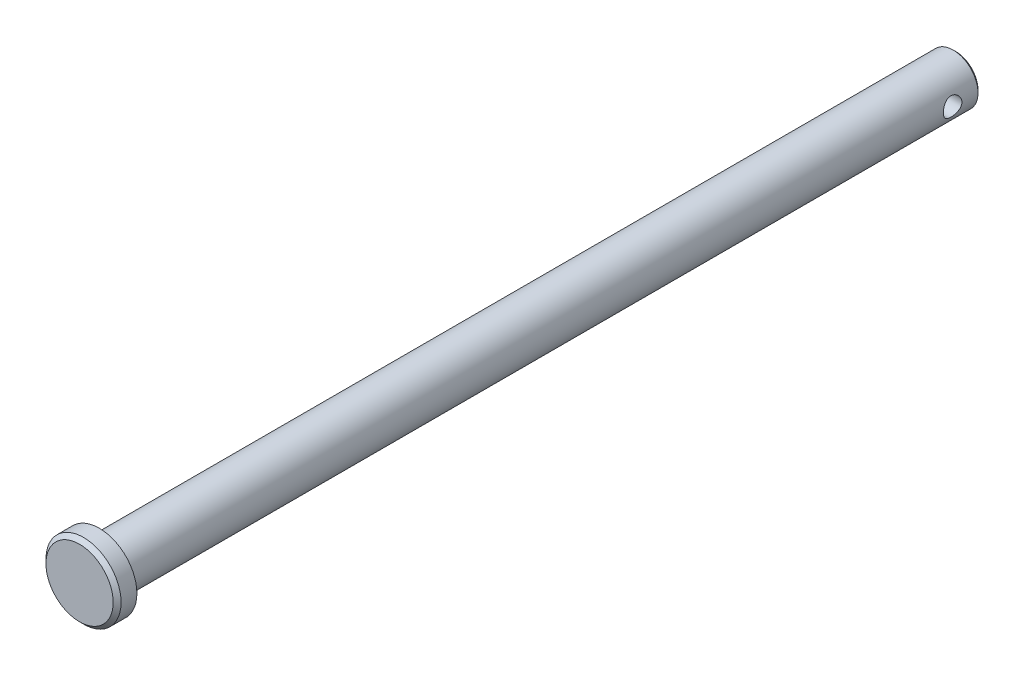
from build123d import *

# Parameters (mm, degrees)
SKETCH1_R           = 3.175
EXTRUDE1_DEPTH      = 55
SKETCH2_R           = 4.826
EXTRUDE2_DEPTH      = 2.54
CHAMFER1_SIZE       = 0.508
EXTRUDE3_DEPTH      = 58.943352958
EXTRUDE3_DEPTH_BACK = 58.943352958
SKETCH3_R           = 1.190625
CHAMFER2_SIZE       = 0.3175


with BuildPart() as part:
    # Sketch1 → Extrude1 (new, symmetric)
    with BuildSketch(Plane.XY):
        Circle(SKETCH1_R)
    extrude(amount=EXTRUDE1_DEPTH, both=True)

    # Sketch2 → Extrude2 (add)
    with BuildSketch(Plane.XY.offset(55)):
        Circle(SKETCH2_R)
    extrude(amount=EXTRUDE2_DEPTH)

    # Chamfer1
    chamfer1_edges = [part.edges().sort_by_distance(p)[0] for p in [
        (-4.826, 0, 57.54),
    ]]
    chamfer(chamfer1_edges, length=CHAMFER1_SIZE)

    # Sketch3 → Extrude3 (cut, two sides: drawn at the far end of the back side and taken through both)
    with BuildSketch(Plane(origin=(0, 0, 0), x_dir=(0, 0, -1), z_dir=(1, 0, 0)).offset(-EXTRUDE3_DEPTH_BACK)):
        with Locations(Location((51.42495, 0, 0), (0, 0, 179.999999999))):
            Circle(SKETCH3_R)
    extrude(amount=EXTRUDE3_DEPTH + EXTRUDE3_DEPTH_BACK, mode=Mode.SUBTRACT)

    # Chamfer2
    chamfer2_edges = [part.edges().sort_by_distance(p)[0] for p in [
        (-3.175, 0, -55),
    ]]
    chamfer(chamfer2_edges, length=CHAMFER2_SIZE)


solid = part.part
